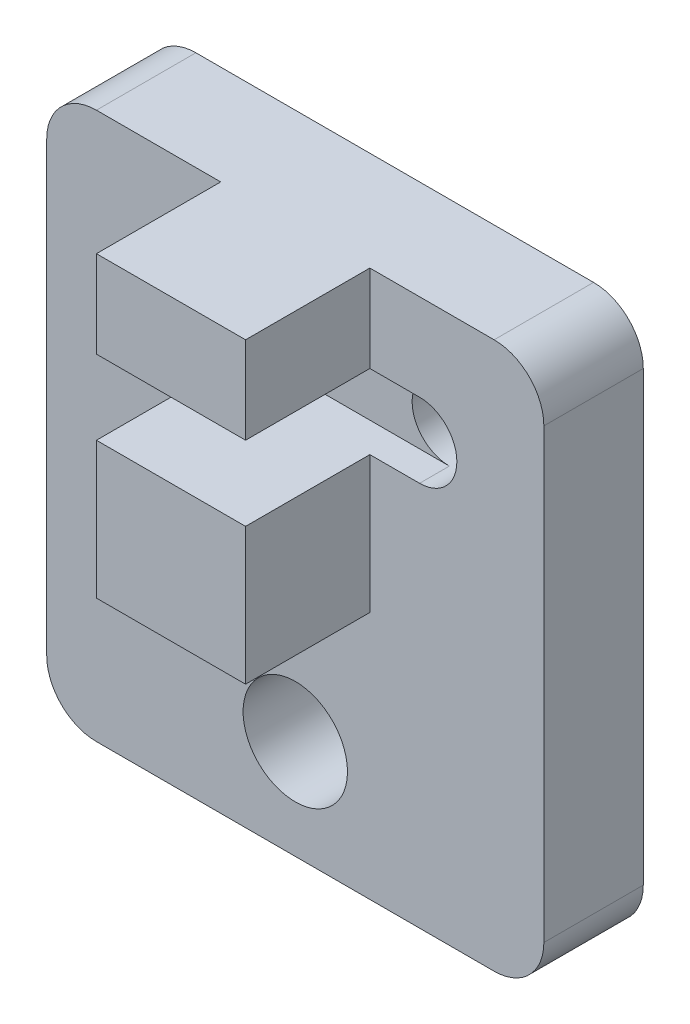
from build123d import *

# Parameters (mm, degrees)
SKETCH_1_R          = 2.1
SKETCH_1_R_2        = 1.5
EXTRUDE_1_DEPTH     = 4
SKETCH_1_3_W        = 6
SKETCH_1_3_H        = 12
EXTRUDE_2_DEPTH     = 9
FILLET_1_R          = 2
CUT_EXTRUDE_START   = -5
CUT_EXTRUDE_1_DEPTH = 10


with BuildPart() as part:
    # 草图1 → 凸台-拉伸1 (new body)
    with BuildSketch(Plane.XY):
        Polygon((0, 22), (0, 0), (20, 0), (20, 22), (13, 22), (13, 10), (7, 10), (7, 22), align=None)
        with Locations((10, 4)):
            Circle(SKETCH_1_R, mode=Mode.SUBTRACT)
        with Locations((5, 17)):
            Circle(SKETCH_1_R_2, mode=Mode.SUBTRACT)
        with Locations((15, 17)):
            Circle(SKETCH_1_R_2, mode=Mode.SUBTRACT)
    extrude(amount=EXTRUDE_1_DEPTH)

    # 草图1<3> → 凸台-拉伸2 (add)
    with BuildSketch(Plane.XY):
        with Locations((10, 16)):
            Rectangle(SKETCH_1_3_W, SKETCH_1_3_H)
    extrude(amount=EXTRUDE_2_DEPTH)

    # 圆角1
    fillet_1_edges = [part.edges().sort_by_distance(p)[0] for p in [
        (20, 0, 2),
        (0, 0, 2),
        (20, 22, 2),
        (0, 22, 2),
    ]]
    fillet(fillet_1_edges, radius=FILLET_1_R)

    # 草图2 → 切除-拉伸1 (cut)
    with BuildSketch(Plane.ZY.offset(CUT_EXTRUDE_START)):
        Polygon((2.8, 18.5), (4, 18.5), (14, 18.5), (14, 15.5), (4, 15.5), (2.8, 15.5), align=None)
    extrude(amount=-CUT_EXTRUDE_1_DEPTH, mode=Mode.SUBTRACT)


solid = part.part
